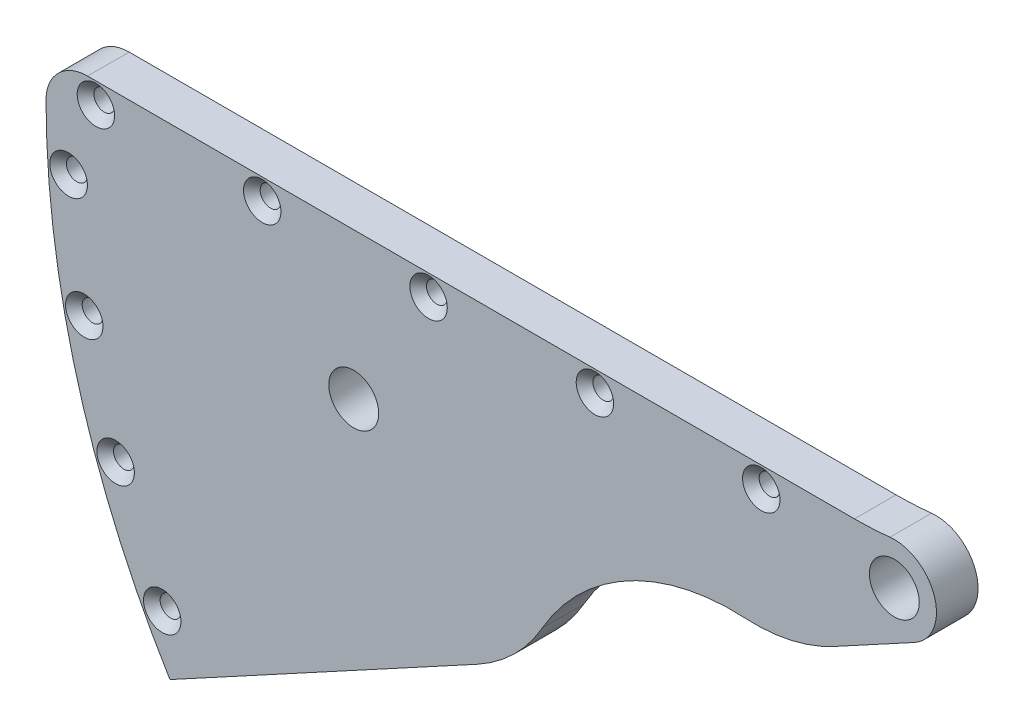
from build123d import *

# Parameters (mm, degrees)
SKETCH1_R           = 2.5
BOSS_EXTRUDE1_DEPTH = 10
CHAMFER1_SIZE       = 2
SKETCH2_R           = 6
CUT_EXTRUDE1_DEPTH  = 48
SKETCH3_R           = 6
CUT_EXTRUDE2_DEPTH  = 14
SKETCH4_R           = 2.528531427
SKETCH4_R_2         = 2.5
CUT_EXTRUDE3_DEPTH  = 14
CHAMFER2_SIZE       = 2
FILLET1_R           = 82


with BuildPart() as part:
    # Sketch1 → Boss-Extrude1 (new body)
    with BuildSketch(Plane.XY):
        with BuildLine():
            Line((55.484867262, -31.782339645), (74.83591229, -21.271406043))
            ThreePointArc((74.83591229, -21.271406043), (79.305955572, -8.361988007), (66.856482862, -2.7366))
            Line((66.856482862, -2.7366), (-123.999650399, -2.7366))
            ThreePointArc((-123.999650399, -2.7366), (-131.077427076, -5.672247424), (-133.999632379, -12.755584536))
            ThreePointArc((-133.999632379, -12.755584536), (-126.357727013, -67.682340192), (-104.205340418, -118.521488224))
            Line((-104.205340418, -118.521488224), (-30.34426595, -78.402267355))
            ThreePointArc((-30.34426595, -78.402267355), (-21.450076132, -71.83180545), (-14.694704232, -63.077233349))
            ThreePointArc((-14.694704232, -63.077233349), (5.93460242, -42.875720255), (34.110442904, -36.567674809))
            ThreePointArc((34.110442904, -36.567674809), (45.131584541, -35.666553732), (55.484867262, -31.782339645))
        make_face()
        with Locations((-122, -7.7366)):
            Circle(SKETCH1_R, mode=Mode.SUBTRACT)
        with Locations((-82, -7.7366)):
            Circle(SKETCH1_R, mode=Mode.SUBTRACT)
        with Locations((-42, -7.7366)):
            Circle(SKETCH1_R, mode=Mode.SUBTRACT)
        with Locations((-2, -7.7366)):
            Circle(SKETCH1_R, mode=Mode.SUBTRACT)
        with Locations((38, -7.7366)):
            Circle(SKETCH1_R, mode=Mode.SUBTRACT)
    extrude(amount=BOSS_EXTRUDE1_DEPTH)

    # Chamfer1
    chamfer1_edges = [part.edges().sort_by_distance(p)[0] for p in [
        (-124.5, -7.7366, 10),
        (-84.5, -7.7366, 10),
        (-44.5, -7.7366, 10),
        (-4.5, -7.7366, 10),
        (35.5, -7.7366, 10),
    ]]
    chamfer(chamfer1_edges, length=CHAMFER1_SIZE)

    # Sketch2 → Cut-Extrude1 (cut)
    with BuildSketch(Plane.XY.offset(10)):
        with Locations((70, -12.3683)):
            Circle(SKETCH2_R)
    extrude(amount=-CUT_EXTRUDE1_DEPTH, mode=Mode.SUBTRACT)

    # Sketch3 → Cut-Extrude2 (cut)
    with BuildSketch(Plane.XY.offset(10)):
        with Locations((-60, -38)):
            Circle(SKETCH3_R)
    extrude(amount=-CUT_EXTRUDE2_DEPTH, mode=Mode.SUBTRACT)

    # Sketch4 → Cut-Extrude3 (cut)
    with BuildSketch(Plane.XY.offset(10)):
        with Locations((-128.565543545, -25.510785173)):
            Circle(SKETCH4_R)
        with Locations((-124.80403691, -53.01786585)):
            Circle(SKETCH4_R_2)
        with Locations((-117.250891281, -79.733748965)):
            Circle(SKETCH4_R_2)
        with Locations((-106.053120049, -105.138440244)):
            Circle(SKETCH4_R_2)
    extrude(amount=-CUT_EXTRUDE3_DEPTH, mode=Mode.SUBTRACT)

    # Chamfer2
    chamfer2_edges = [part.edges().sort_by_distance(p)[0] for p in [
        (-131.094074972, -25.510785173, 10),
        (-127.30403691, -53.01786585, 10),
        (-119.750891281, -79.733748965, 10),
        (-108.553120049, -105.138440244, 10),
    ]]
    chamfer(chamfer2_edges, length=CHAMFER2_SIZE)

    # Fillet1
    fillet1_edges = [part.edges().sort_by_distance(p)[0] for p in [
        (66.856482862, -2.7366, 5),
    ]]
    fillet(fillet1_edges, radius=FILLET1_R)


solid = part.part
